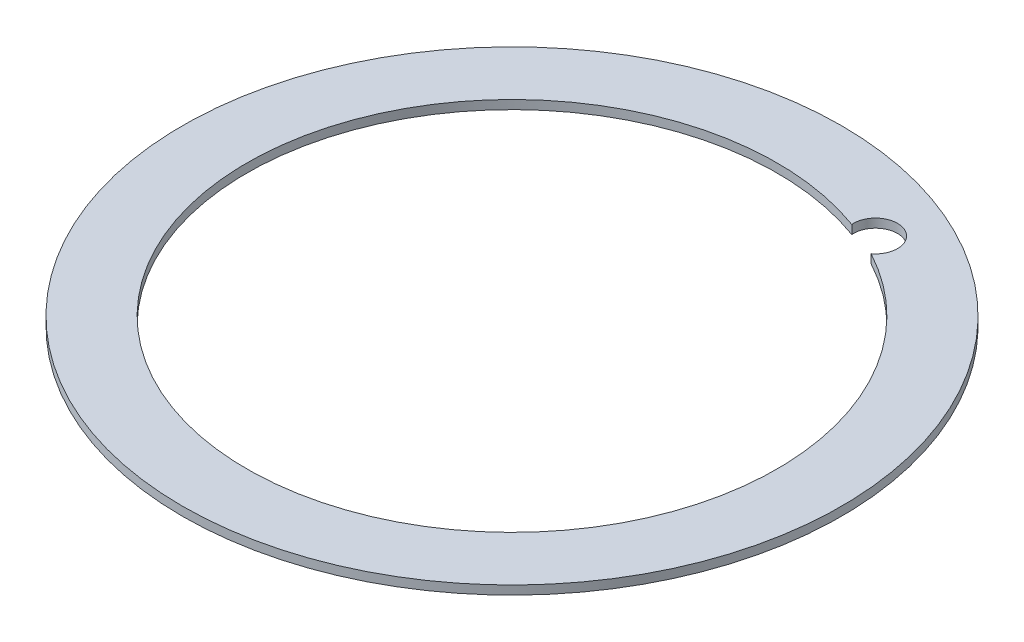
from build123d import *

# Parameters (mm, degrees)
SKETCH1_R           = 142.875
BOSS_EXTRUDE2_DEPTH = 3.81


with BuildPart() as part:
    # Sketch1 → Boss-Extrude2 (new body)
    with BuildSketch(Plane(origin=(0, 0, 0), x_dir=(1, 0, 0), z_dir=(0, 1, 0))):
        with Locations(Location((0, 0, 0), (0, 0, 270))):
            Circle(SKETCH1_R)
        with BuildLine():
            ThreePointArc((54.490337546, 101.1971212), (98.67345431, 58.937285648), (114.935, 0))
            ThreePointArc((114.935, 0), (-94.142770704, -65.933246159), (39.288887865, 108.011284204))
            ThreePointArc((39.288887865, 108.011284204), (48.374639999, 118.336615411), (58.304474981, 108.820222521))
            ThreePointArc((58.304474981, 108.820222521), (57.297737448, 104.558200756), (54.490337546, 101.1971212))
        make_face(mode=Mode.SUBTRACT)
    extrude(amount=-BOSS_EXTRUDE2_DEPTH)


solid = part.part
